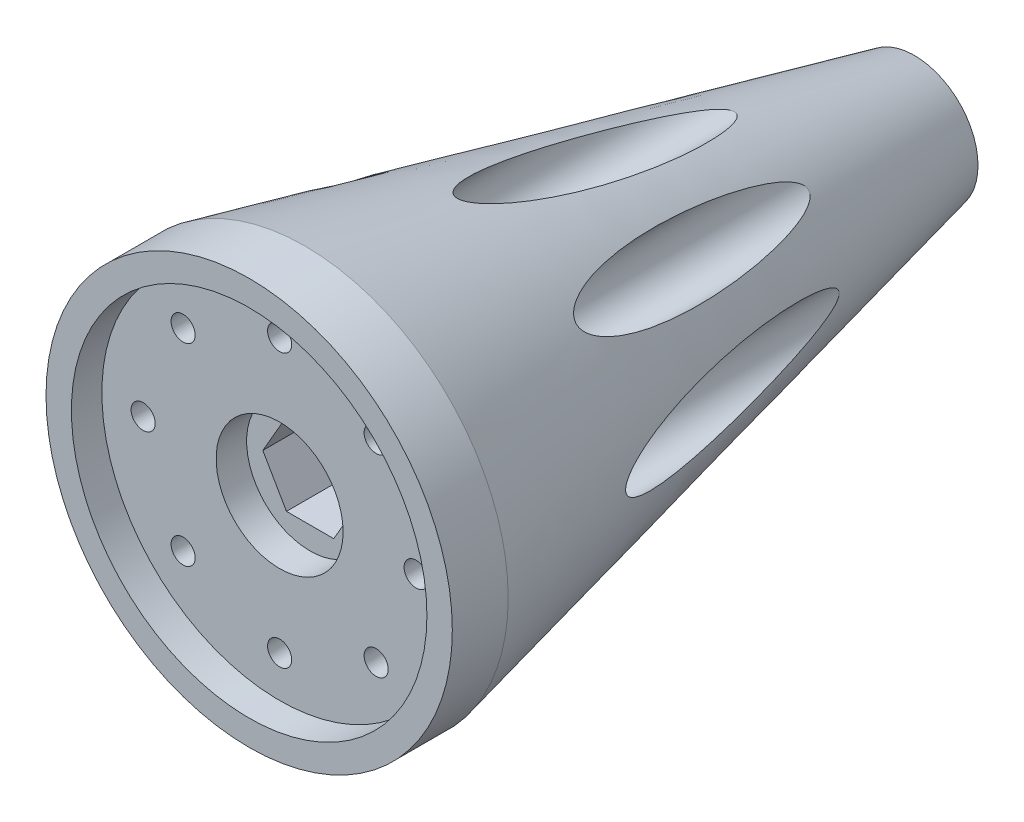
from build123d import *

# Parameters (mm, degrees)
CUT_EXTRUDE1_REACH = 59.077
CUT_EXTRUDE2_REACH = 59.077
SKETCH4_R          = 0.95
SKETCH5_R          = 2.5
CUT_EXTRUDE3_DEPTH = 47
SKETCH6_R          = 5
CUT_EXTRUDE4_DEPTH = 2.4


with BuildPart() as part:
    # Sketch2 → Revolve1 (revolve)
    with BuildSketch(Plane(origin=(0, 0, 0), x_dir=(0, 0, -1), z_dir=(1, 0, 0)), mode=Mode.PRIVATE) as revolve1_sk:
        Polygon((0, 14), (2.4, 14), (2.4, 0), (52.4, 0), (52.4, 5), (4.4, 16), (0, 16), align=None)
    revolve(revolve1_sk.sketch.rotate(Axis((0, 0, 0), (0, 0, -1)), 90), axis=Axis((0, 0, 0), (0, 0, -1)))

    # Sketch3 → Cut-Extrude1 (cut, up to next)
    with BuildSketch(Plane.XY, mode=Mode.PRIVATE) as cut_extrude1_sk1:
        Polygon((3.723909236, 0), (1.861954618, 3.225), (-1.861954618, 3.225), (-3.723909236, 0), (-1.861954618, -3.225), (1.861954618, -3.225), align=None)
    cut_extrude1_tool1 = extrude(cut_extrude1_sk1.sketch, amount=-CUT_EXTRUDE1_REACH, mode=Mode.PRIVATE) & part.part
    add(cut_extrude1_tool1.solids().sort_by_distance((0, 0, 0))[0], mode=Mode.SUBTRACT)

    # Sketch4 → Cut-Extrude2 (cut, up to next)
    with BuildSketch(Plane.XY, mode=Mode.PRIVATE) as cut_extrude2_sk1:
        with Locations(Location((0, 10.75, 0), (0, 0, 266.983855867))):
            Circle(SKETCH4_R)
    cut_extrude2_tool1 = extrude(cut_extrude2_sk1.sketch, amount=-CUT_EXTRUDE2_REACH, mode=Mode.PRIVATE) & part.part
    # Sketch4 → Cut-Extrude2 (cut, up to next)
    with BuildSketch(Plane.XY, mode=Mode.PRIVATE) as cut_extrude2_sk2:
        with Locations(Location((7.601397898, 7.601397898, 0), (0, 0, 225))):
            Circle(SKETCH4_R)
    cut_extrude2_tool2 = extrude(cut_extrude2_sk2.sketch, amount=-CUT_EXTRUDE2_REACH, mode=Mode.PRIVATE) & part.part
    # Sketch4 → Cut-Extrude2 (cut, up to next)
    with BuildSketch(Plane.XY, mode=Mode.PRIVATE) as cut_extrude2_sk3:
        with Locations(Location((10.75, 0, 0), (0, 0, 359.999908017))):
            Circle(SKETCH4_R)
    cut_extrude2_tool3 = extrude(cut_extrude2_sk3.sketch, amount=-CUT_EXTRUDE2_REACH, mode=Mode.PRIVATE) & part.part
    # Sketch4 → Cut-Extrude2 (cut, up to next)
    with BuildSketch(Plane.XY, mode=Mode.PRIVATE) as cut_extrude2_sk4:
        with Locations(Location((7.601397898, -7.601397898, 0), (0, 0, 135))):
            Circle(SKETCH4_R)
    cut_extrude2_tool4 = extrude(cut_extrude2_sk4.sketch, amount=-CUT_EXTRUDE2_REACH, mode=Mode.PRIVATE) & part.part
    # Sketch4 → Cut-Extrude2 (cut, up to next)
    with BuildSketch(Plane.XY, mode=Mode.PRIVATE) as cut_extrude2_sk5:
        with Locations(Location((0, -10.75, 0), (0, 0, 93.016144133))):
            Circle(SKETCH4_R)
    cut_extrude2_tool5 = extrude(cut_extrude2_sk5.sketch, amount=-CUT_EXTRUDE2_REACH, mode=Mode.PRIVATE) & part.part
    # Sketch4 → Cut-Extrude2 (cut, up to next)
    with BuildSketch(Plane.XY, mode=Mode.PRIVATE) as cut_extrude2_sk6:
        with Locations(Location((-7.601397898, -7.601397898, 0), (0, 0, 153.36144182))):
            Circle(SKETCH4_R)
    cut_extrude2_tool6 = extrude(cut_extrude2_sk6.sketch, amount=-CUT_EXTRUDE2_REACH, mode=Mode.PRIVATE) & part.part
    # Sketch4 → Cut-Extrude2 (cut, up to next)
    with BuildSketch(Plane.XY, mode=Mode.PRIVATE) as cut_extrude2_sk7:
        with Locations(Location((-10.75, 0, 0), (0, 0, 193.412541959))):
            Circle(SKETCH4_R)
    cut_extrude2_tool7 = extrude(cut_extrude2_sk7.sketch, amount=-CUT_EXTRUDE2_REACH, mode=Mode.PRIVATE) & part.part
    # Sketch4 → Cut-Extrude2 (cut, up to next)
    with BuildSketch(Plane.XY, mode=Mode.PRIVATE) as cut_extrude2_sk8:
        with Locations(Location((-7.601397898, 7.601397898, 0), (0, 0, 315))):
            Circle(SKETCH4_R)
    cut_extrude2_tool8 = extrude(cut_extrude2_sk8.sketch, amount=-CUT_EXTRUDE2_REACH, mode=Mode.PRIVATE) & part.part
    add(cut_extrude2_tool1.solids().sort_by_distance((0, 10.75, 0))[0], mode=Mode.SUBTRACT)
    add(cut_extrude2_tool2.solids().sort_by_distance((7.601398, 7.601398, 0))[0], mode=Mode.SUBTRACT)
    add(cut_extrude2_tool3.solids().sort_by_distance((10.75, 0, 0))[0], mode=Mode.SUBTRACT)
    add(cut_extrude2_tool4.solids().sort_by_distance((7.601398, -7.601398, 0))[0], mode=Mode.SUBTRACT)
    add(cut_extrude2_tool5.solids().sort_by_distance((0, -10.75, 0))[0], mode=Mode.SUBTRACT)
    add(cut_extrude2_tool6.solids().sort_by_distance((-7.601398, -7.601398, 0))[0], mode=Mode.SUBTRACT)
    add(cut_extrude2_tool7.solids().sort_by_distance((-10.75, 0, 0))[0], mode=Mode.SUBTRACT)
    add(cut_extrude2_tool8.solids().sort_by_distance((-7.601398, 7.601398, 0))[0], mode=Mode.SUBTRACT)

    # Sketch5 → Cut-Extrude3 (cut)
    with BuildSketch(Plane(origin=(0, 0, -52.4), x_dir=(-1, 0, 0), z_dir=(0, 0, -1))):
        with Locations((0, 10.75)):
            Circle(SKETCH5_R)
        with Locations((7.601397898, 7.601397898)):
            Circle(SKETCH5_R)
        with Locations((10.75, 0)):
            Circle(SKETCH5_R)
        with Locations((7.601397898, -7.601397898)):
            Circle(SKETCH5_R)
        with Locations((0, -10.75)):
            Circle(SKETCH5_R)
        with Locations((-7.601397898, -7.601397898)):
            Circle(SKETCH5_R)
        with Locations((-10.75, 0)):
            Circle(SKETCH5_R)
        with Locations((-7.601397898, 7.601397898)):
            Circle(SKETCH5_R)
    extrude(amount=-CUT_EXTRUDE3_DEPTH, mode=Mode.SUBTRACT)

    # Sketch6 → Cut-Extrude4 (cut)
    with BuildSketch(Plane.XY.offset(-2.4)):
        Circle(SKETCH6_R)
    extrude(amount=-CUT_EXTRUDE4_DEPTH, mode=Mode.SUBTRACT)


solid = part.part
